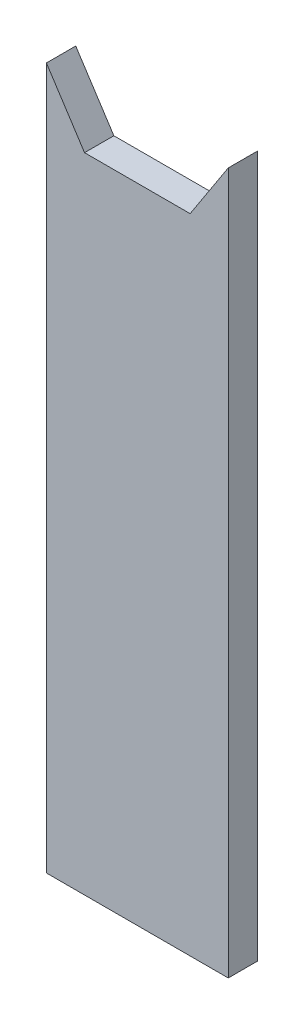
from build123d import *

# Parameters (mm, degrees)
BOSS_EXTRUDE1_DEPTH = 5


with BuildPart() as part:
    # Sketch1 → Boss-Extrude1 (new body)
    with BuildSketch(Plane.XY):
        Polygon((15.5, 109.404302294), (15.5, -10.195697706), (-15.5, -10.195697706), (-15.5, 109.404302294), (-9, 99.404302294), (9, 99.404302294), align=None)
    extrude(amount=BOSS_EXTRUDE1_DEPTH)


solid = part.part
